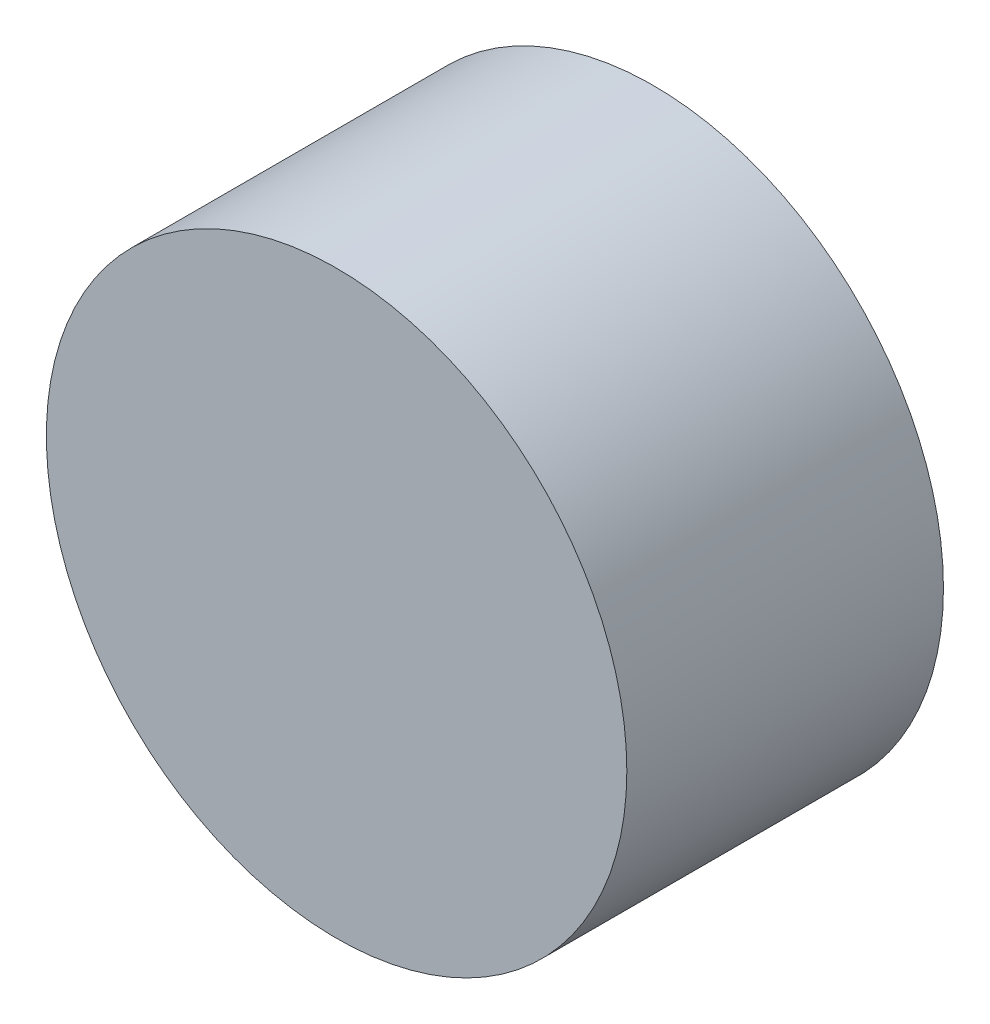
from build123d import *

# Parameters (mm, degrees)
ESQUISSE1_R        = 55
BOSS_EXTRU_1_DEPTH = 60


with BuildPart() as part:
    # Esquisse1 → Boss.-Extru.1 (new body)
    with BuildSketch(Plane.XY):
        Circle(ESQUISSE1_R)
    extrude(amount=BOSS_EXTRU_1_DEPTH)


solid = part.part
